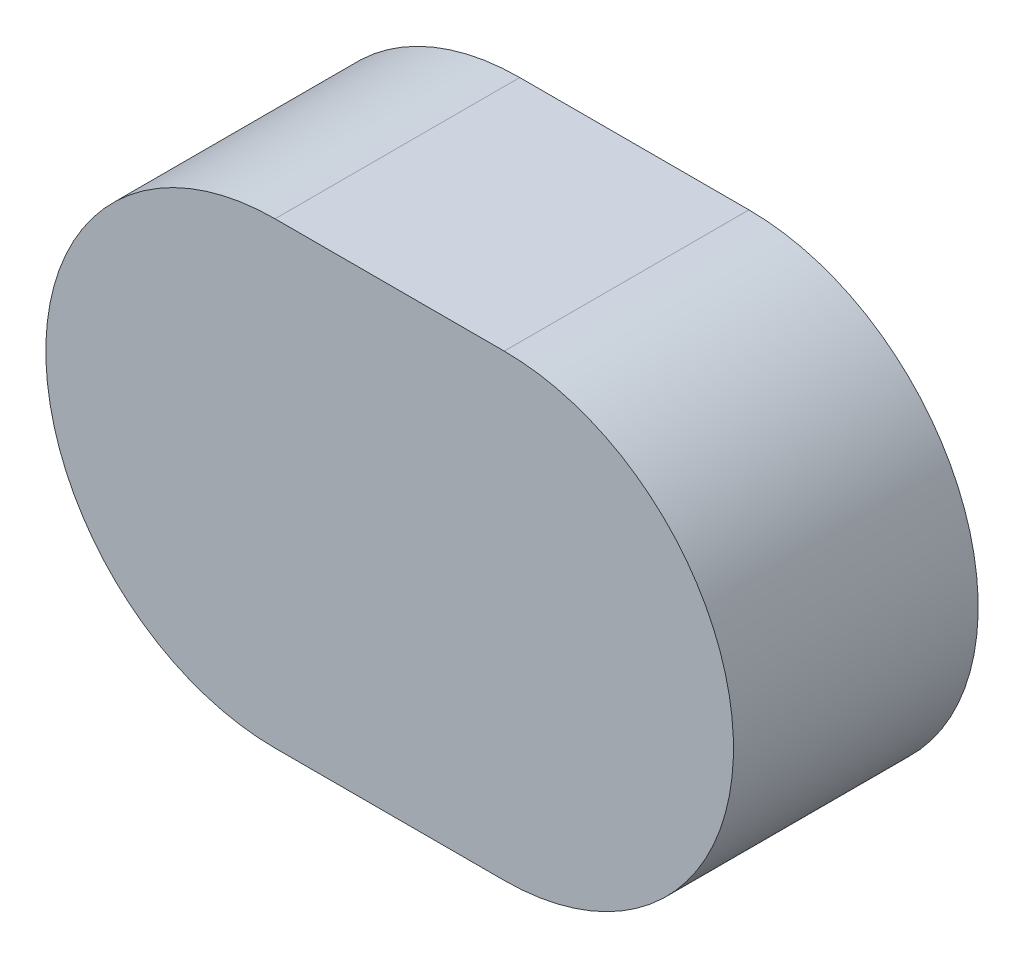
from build123d import *

# Parameters (mm, degrees)
EXTRUDE_1_DEPTH = 4.27


with BuildPart() as part:
    # 草图1 → 凸台-拉伸1 (new body)
    with BuildSketch(Plane.XY):
        with BuildLine():
            Line((-17.875968791, 4), (-13.875968791, 4))
            ThreePointArc((-13.875968791, 4), (-9.875968791, 0), (-13.875968791, -4))
            Line((-13.875968791, -4), (-17.875968791, -4))
            ThreePointArc((-17.875968791, -4), (-21.875968791, 0), (-17.875968791, 4))
        make_face()
    extrude(amount=EXTRUDE_1_DEPTH)


solid = part.part
